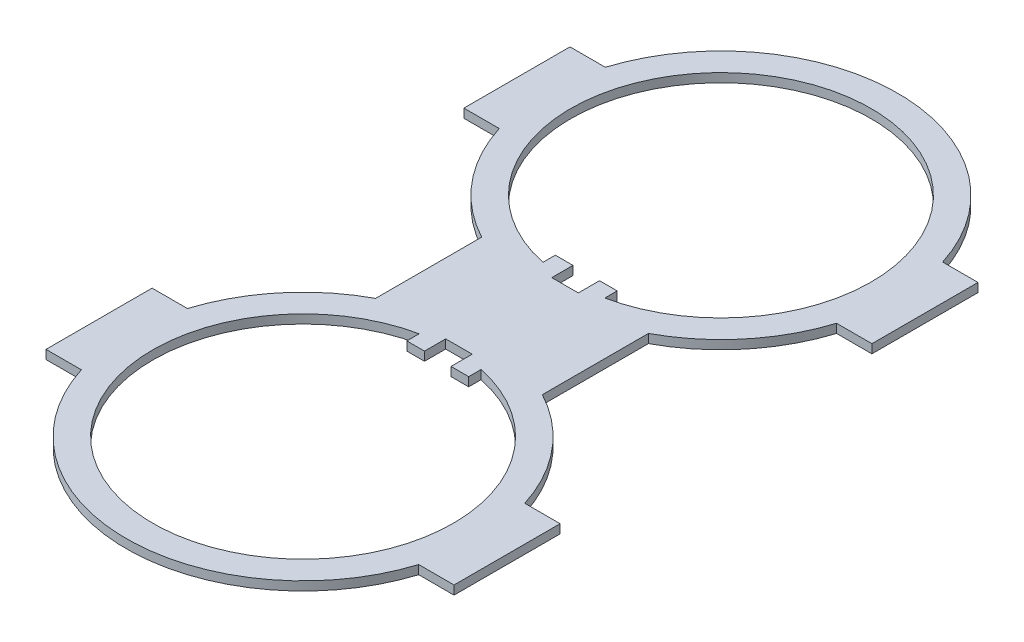
from build123d import *

# Parameters (mm, degrees)
BOSS_EXTRUDE1_DEPTH = 6.35


with BuildPart() as part:
    # Sketch1 → Boss-Extrude1 (new body)
    with BuildSketch(Plane(origin=(0, 0, 0), x_dir=(1, 0, 0), z_dir=(0, 1, 0))):
        with BuildLine():
            Line((130.67527858, 150.087360224), (156.07527858, 150.087360224))
            Line((156.07527858, 150.087360224), (156.07527858, 73.887360224))
            Line((156.07527858, 73.887360224), (130.67527858, 73.887360224))
            ThreePointArc((130.67527858, 73.887360224), (107.297701698, 30.934915456), (69.423507078, 0))
            Line((69.423507078, 0), (69.423507078, -76.2))
            ThreePointArc((69.423507078, -76.2), (107.297701698, -107.134915456), (130.67527858, -150.087360224))
            Line((130.67527858, -150.087360224), (156.07527858, -150.087360224))
            Line((156.07527858, -150.087360224), (156.07527858, -226.287360224))
            Line((156.07527858, -226.287360224), (130.67527858, -226.287360224))
            ThreePointArc((130.67527858, -226.287360224), (9.525, -315.187360224), (-111.62527858, -226.287360224))
            Line((-111.62527858, -226.287360224), (-137.02527858, -226.287360224))
            Line((-137.02527858, -226.287360224), (-137.02527858, -150.087360224))
            Line((-137.02527858, -150.087360224), (-111.62527858, -150.087360224))
            ThreePointArc((-111.62527858, -150.087360224), (-88.247701698, -107.134915456), (-50.373507078, -76.2))
            Line((-50.373507078, -76.2), (-50.373507078, 0))
            ThreePointArc((-50.373507078, 0), (-88.247701698, 30.934915456), (-111.62527858, 73.887360224))
            Line((-111.62527858, 73.887360224), (-137.02527858, 73.887360224))
            Line((-137.02527858, 73.887360224), (-137.02527858, 150.087360224))
            Line((-137.02527858, 150.087360224), (-111.62527858, 150.087360224))
            ThreePointArc((-111.62527858, 150.087360224), (9.525, 238.987360224), (130.67527858, 150.087360224))
        make_face()
        with BuildLine():
            Line((0, 0), (19.05, 0))
            Line((19.05, 0), (19.05, 15.24))
            Line((19.05, 15.24), (31.75, 15.24))
            Line((31.75, 15.24), (31.75, 6.35))
            ThreePointArc((31.75, 6.35), (9.525, 219.937360224), (-12.7, 6.35))
            Line((-12.7, 6.35), (-12.7, 15.24))
            Line((-12.7, 15.24), (0, 15.24))
            Line((0, 15.24), (0, 0))
        make_face(mode=Mode.SUBTRACT)
        with BuildLine():
            Line((0, -76.2), (19.05, -76.2))
            Line((19.05, -76.2), (19.05, -91.44))
            Line((19.05, -91.44), (31.75, -91.44))
            Line((31.75, -91.44), (31.75, -82.55))
            ThreePointArc((31.75, -82.55), (9.525, -296.137360224), (-12.7, -82.55))
            Line((-12.7, -82.55), (-12.7, -91.44))
            Line((-12.7, -91.44), (0, -91.44))
            Line((0, -91.44), (0, -76.2))
        make_face(mode=Mode.SUBTRACT)
    extrude(amount=BOSS_EXTRUDE1_DEPTH)


solid = part.part
